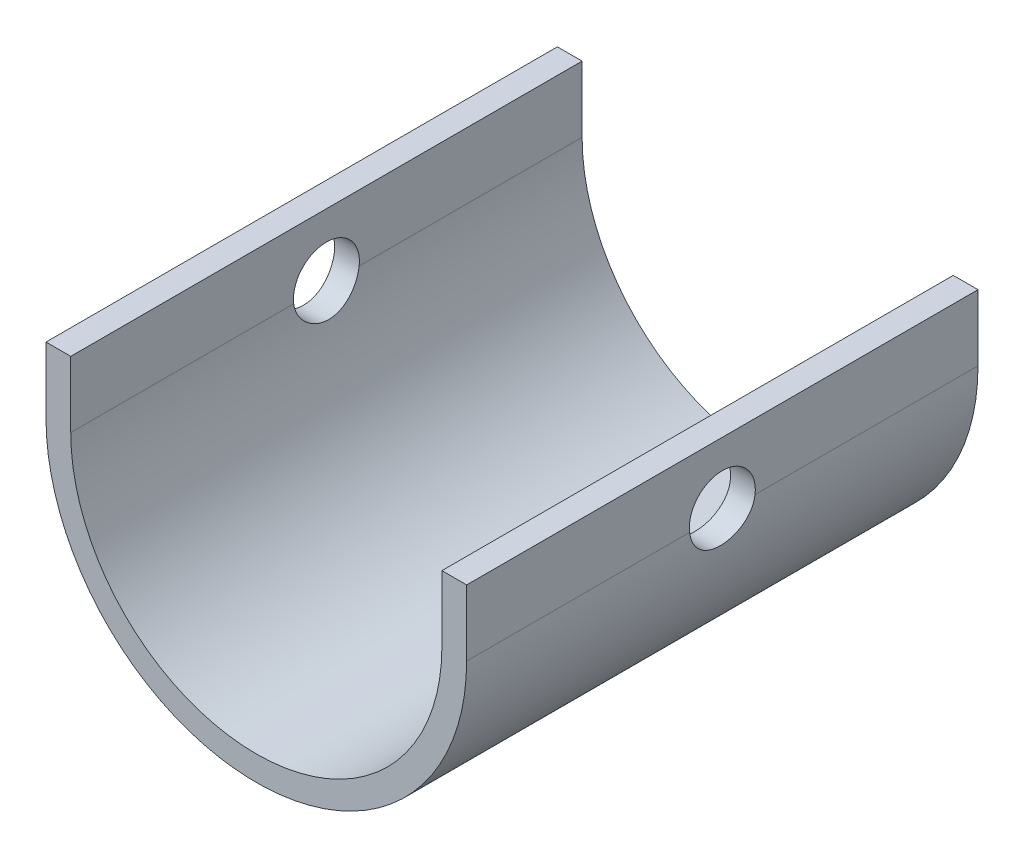
from build123d import *

# Parameters (mm, degrees)
SKETCH1_R           = 12.75
BOSS_EXTRUDE1_DEPTH = 31
SKETCH2_R           = 11.25
CUT_EXTRUDE1_DEPTH  = 31
SKETCH3_W           = 26.062962729
SKETCH3_H           = 13.122907939
CUT_EXTRUDE2_DEPTH  = 31
SKETCH8_W           = 1.5
SKETCH8_H           = 31
BOSS_EXTRUDE3_DEPTH = 4
SKETCH11_R          = 2
CUT_EXTRUDE3_DEPTH  = 2
CUT_EXTRUDE4_START  = -2
SKETCH9_R           = 2
CUT_EXTRUDE4_DEPTH  = 2


with BuildPart() as part:
    # Sketch1 → Boss-Extrude1 (new body)
    with BuildSketch(Plane.XY):
        Circle(SKETCH1_R)
    extrude(amount=-BOSS_EXTRUDE1_DEPTH)

    # Sketch2 → Cut-Extrude1 (cut)
    with BuildSketch(Plane.XY):
        Circle(SKETCH2_R)
    extrude(amount=-CUT_EXTRUDE1_DEPTH, mode=Mode.SUBTRACT)

    # Sketch3 → Cut-Extrude2 (cut)
    with BuildSketch(Plane.XY):
        with Locations((0.281481365, 6.56145397)):
            Rectangle(SKETCH3_W, SKETCH3_H)
    extrude(amount=-CUT_EXTRUDE2_DEPTH, mode=Mode.SUBTRACT)

    # Sketch8 → Boss-Extrude3 (add)
    with BuildSketch(Plane(origin=(0, 0, 0), x_dir=(1, 0, 0), z_dir=(0, 1, 0))):
        with Locations((-12, 15.5)):
            Rectangle(SKETCH8_W, SKETCH8_H)
        with Locations((12, 15.5)):
            Rectangle(SKETCH8_W, SKETCH8_H)
    extrude(amount=BOSS_EXTRUDE3_DEPTH)

    # Sketch11 → Cut-Extrude3 (cut)
    with BuildSketch(Plane.ZY.offset(12.75)):
        with Locations(Location((-15.5, 0.25, 0), (0, 0, 352.819244219))):
            Circle(SKETCH11_R)
    extrude(amount=-CUT_EXTRUDE3_DEPTH, mode=Mode.SUBTRACT)

    # Sketch9 → Cut-Extrude4 (cut)
    with BuildSketch(Plane(origin=(12.75, 0, 0), x_dir=(0, 0, -1), z_dir=(1, 0, 0)).offset(CUT_EXTRUDE4_START)):
        with Locations(Location((15.5, 0.25, 0), (0, 0, 187.180755781))):
            Circle(SKETCH9_R)
    extrude(amount=CUT_EXTRUDE4_DEPTH, mode=Mode.SUBTRACT)


solid = part.part
